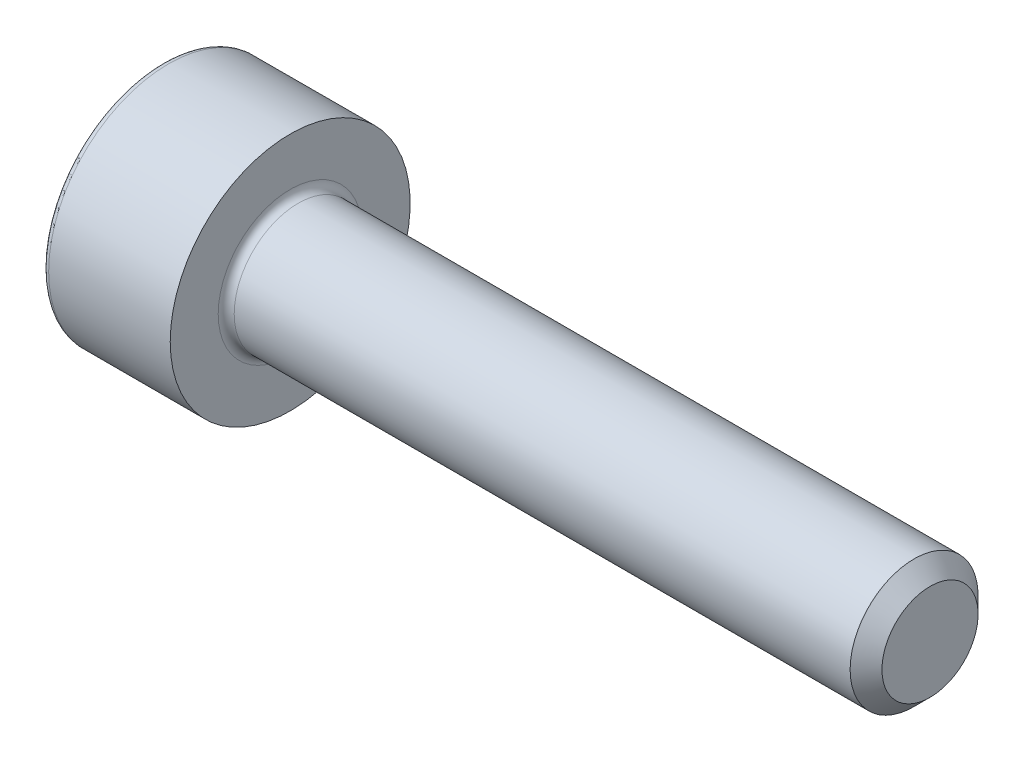
from build123d import *

# Parameters (mm, degrees)
FILLET1_R    = 0.1
FILLET2_R    = 0.08
HEX_2_DEPTH  = 0.7
SCALE1_SCALE = 2.5


with BuildPart() as part:
    # BodySke → BaseBody (revolve)
    with BuildSketch(Plane.XY, mode=Mode.PRIVATE) as basebody_sk:
        Polygon((0, 0), (0, 1.5), (1.6, 1.5), (1.6, 0.8), (9.401, 0.8), (9.6, 0.601), (9.6, 0), align=None)
    revolve(basebody_sk.sketch.rotate(Axis((0, 0, 0), (1, 0, 0)), 90), axis=Axis((0, 0, 0), (1, 0, 0)))

    # Fillet1
    fillet1_edges = [part.edges().sort_by_distance(p)[0] for p in [
        (1.6, 0, -0.8),
    ]]
    fillet(fillet1_edges, radius=FILLET1_R)

    # Fillet2
    fillet2_edges = [part.edges().sort_by_distance(p)[0] for p in [
        (0, 0, -1.5),
    ]]
    fillet(fillet2_edges, radius=FILLET2_R)

    # HexSke → Hex 2 (cut)
    with BuildSketch(Plane(origin=(0, 0, 0), x_dir=(0, 0, -1), z_dir=(1, 0, 0))):
        Polygon((0, 0.866025404), (-0.75, 0.433012702), (-0.75, -0.433012702), (0, -0.866025404), (0.75, -0.433012702), (0.75, 0.433012702), align=None)
    extrude(amount=HEX_2_DEPTH, mode=Mode.SUBTRACT)

    # Hex-PreBroachSke → Hex-PreBroach (revolve, cut)
    with BuildSketch(Plane.XY, mode=Mode.PRIVATE) as hex_prebroach_sk:
        Polygon((0, 0), (0, 0.75), (0.7, 0.75), (1.133012702, 0), align=None)
    revolve(hex_prebroach_sk.sketch.rotate(Axis((0, 0, 0), (1, 0, 0)), 270), axis=Axis((0, 0, 0), (1, 0, 0)), mode=Mode.SUBTRACT)


with BuildPart() as part_1:
    # Scale1: scaled about (3.799750462, 0, 0)
    add(part.part.scale(SCALE1_SCALE).moved(Location((-5.699625693, 0, 0))))


solid = part_1.part
